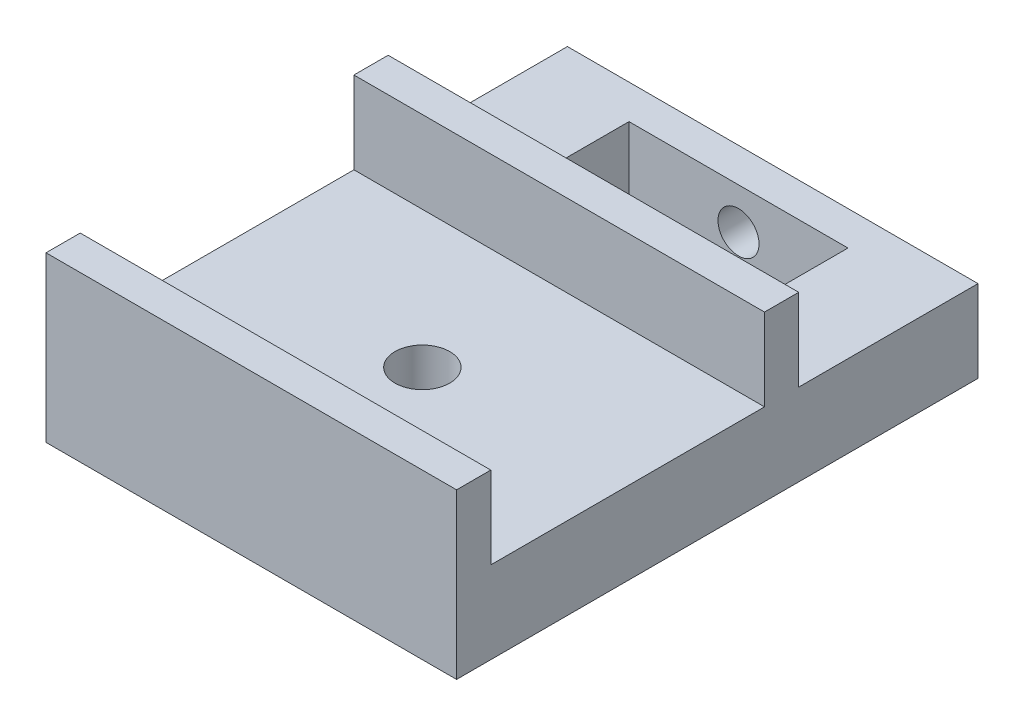
from build123d import *

# Parameters (mm, degrees)
SKETCH1_W           = 30
SKETCH1_H           = 38.1
SKETCH1_W_2         = 16
SKETCH1_H_2         = 10.6
BOSS_EXTRUDE1_DEPTH = 6
SKETCH1_3_W         = 30
SKETCH1_3_H         = 2.5
BOSS_EXTRUDE2_DEPTH = 12
SKETCH3_R           = 1.5
CUT_EXTRUDE2_DEPTH  = 15
SKETCH2_R           = 2
CUT_EXTRUDE1_DEPTH  = 38.976966704


with BuildPart() as part:
    # Sketch1 → Boss-Extrude1 (new body)
    with BuildSketch(Plane(origin=(0, 0, 0), x_dir=(1, 0, 0), z_dir=(0, 1, 0))):
        with Locations((-15, -3.45)):
            Rectangle(SKETCH1_W, SKETCH1_H)
        with Locations((-15, 7.8)):
            Rectangle(SKETCH1_W_2, SKETCH1_H_2, mode=Mode.SUBTRACT)
    extrude(amount=BOSS_EXTRUDE1_DEPTH)

    # Sketch1<3> → Boss-Extrude2 (add)
    with BuildSketch(Plane(origin=(0, 0, 0), x_dir=(1, 0, 0), z_dir=(0, 1, 0))):
        with Locations((-15, -21.25)):
            Rectangle(SKETCH1_3_W, SKETCH1_3_H)
        with Locations((-15, 1.25)):
            Rectangle(SKETCH1_3_W, SKETCH1_3_H)
    extrude(amount=BOSS_EXTRUDE2_DEPTH)

    # Sketch3 → Cut-Extrude2 (cut)
    with BuildSketch(Plane(origin=(0, 0, -15.6), x_dir=(-1, 0, 0), z_dir=(0, 0, -1))):
        with Locations((15, 3)):
            Circle(SKETCH3_R)
    extrude(amount=-CUT_EXTRUDE2_DEPTH, mode=Mode.SUBTRACT)

    # Sketch2 → Cut-Extrude1 (cut, through all)
    with BuildSketch(Plane(origin=(0, 6, 0), x_dir=(1, 0, 0), z_dir=(0, 1, 0))):
        with Locations((-15, -10)):
            Circle(SKETCH2_R)
    extrude(amount=-CUT_EXTRUDE1_DEPTH, mode=Mode.SUBTRACT)


solid = part.part
